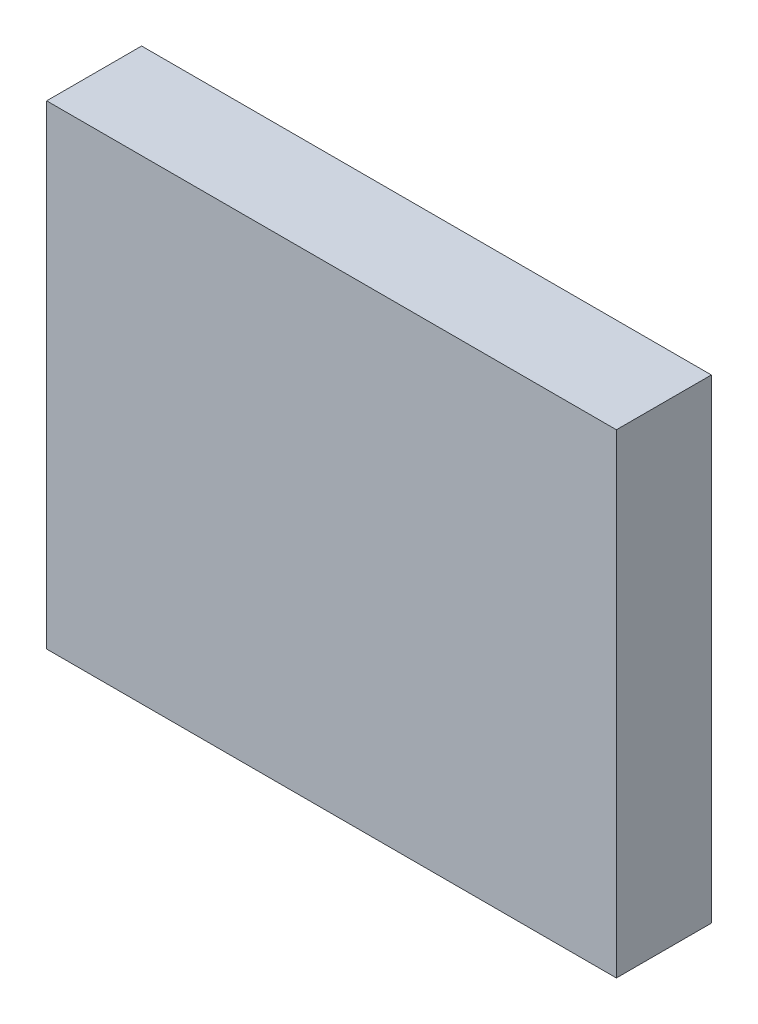
from build123d import *

# Parameters (mm, degrees)
ESQUISSE1_W        = 60
ESQUISSE1_H        = 50
BOSS_EXTRU_1_DEPTH = 10


with BuildPart() as part:
    # Esquisse1 → Boss.-Extru.1 (new body)
    with BuildSketch(Plane.XY):
        Rectangle(ESQUISSE1_W, ESQUISSE1_H)
    extrude(amount=BOSS_EXTRU_1_DEPTH)


solid = part.part
